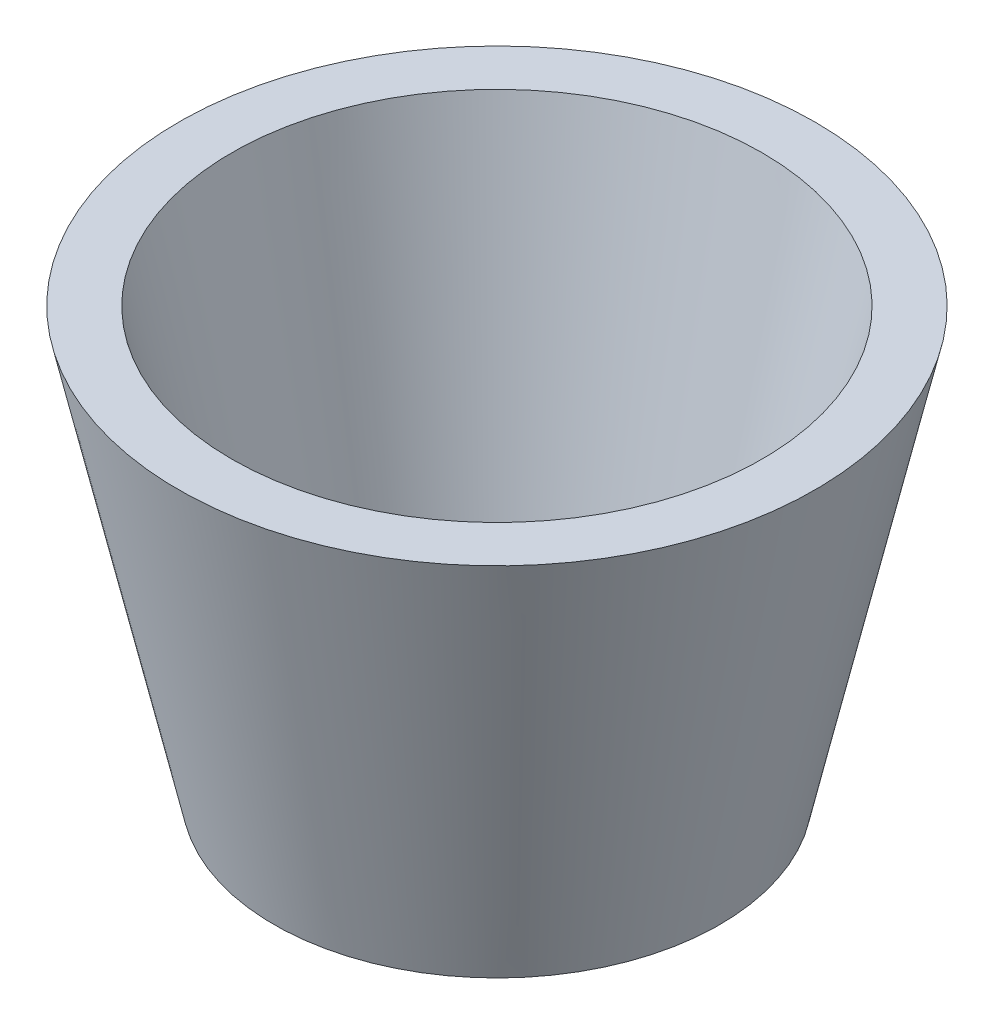
from build123d import *


with BuildPart() as part:
    # Sketch1 → Revolve2 (revolve)
    with BuildSketch(Plane.XY, mode=Mode.PRIVATE) as revolve2_sk:
        Polygon((20, 0), (42, 0), (60, 80), (50, 80), (34.25, 10), (20, 10), (6, 10), (6, 0), align=None)
    revolve(revolve2_sk.sketch.rotate(Axis((0, 0, 0), (0, 1, 0)), 90), axis=Axis((0, 0, 0), (0, 1, 0)))


solid = part.part
